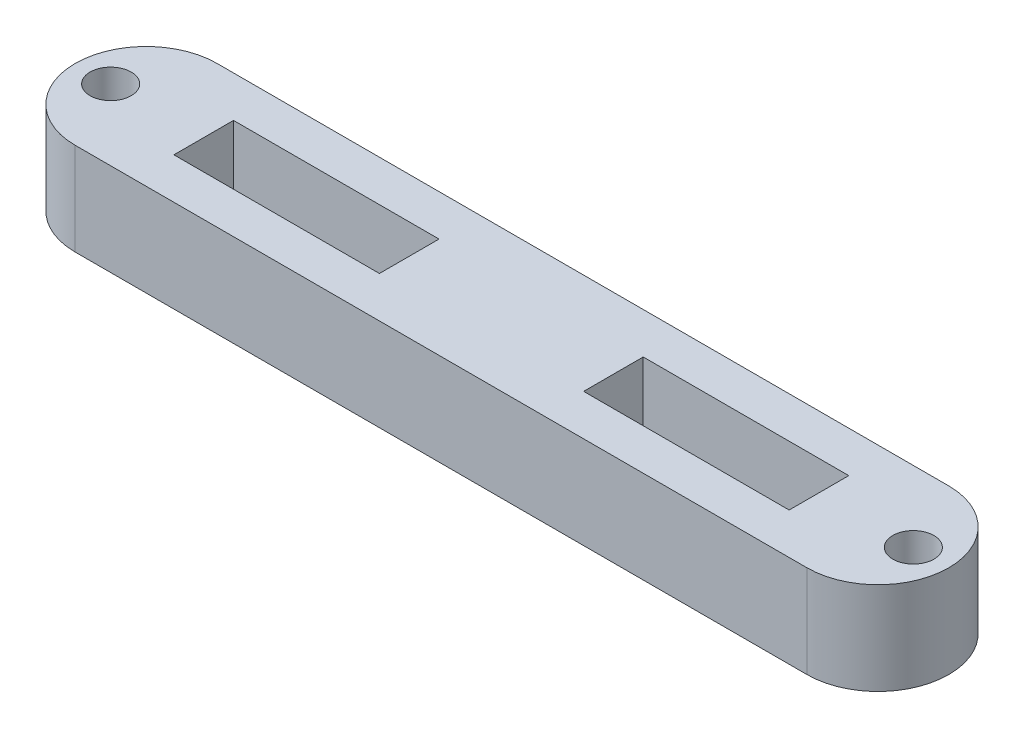
from build123d import *

# Parameters (mm, degrees)
SKETCH1_W                = 22.609360872
SKETCH1_H                = 4.3815
SKETCH1_W_2              = 6.35
SKETCH1_H_2              = 1.8415
BOSS_EXTRUDE1_DEPTH      = 6.35
BOSS_EXTRUDE2_REACH      = 15.15
BOSS_EXTRUDE3_START      = 2.19075
BOSS_EXTRUDE3_DEPTH      = 2.19075
SKETCH7_R                = 1.5875
BOSS_EXTRUDE4_DEPTH      = 1.27
MIRROR2_COPY_1_SKETCH_R  = 1.5875
MIRROR2_COPY_1_DEPTH     = 1.27
BOSS_EXTRUDE5_DEPTH      = 6.35
BOSS_EXTRUDE5_DEPTH_BACK = 1.27
SKETCH8_R                = 0.635
SKETCH9_W                = 22.609360872
SKETCH9_H                = 6.35
BOSS_EXTRUDE6_DEPTH      = 4.3815
SKETCH10_W               = 6.35
SKETCH10_H               = 1.8415
CUT_EXTRUDE1_DEPTH       = 12.7
CUT_EXTRUDE2_DEPTH       = 23.114
CUT_EXTRUDE2_DEPTH_BACK  = 4.7625
SKETCH12_W               = 31.633822951
SKETCH12_H               = 14.456952732


with BuildPart() as part:
    # Sketch1 → Boss-Extrude1 (new body)
    with BuildSketch(Plane(origin=(0, 0, 0), x_dir=(1, 0, 0), z_dir=(0, 1, 0))):
        Rectangle(SKETCH1_W, SKETCH1_H)
        with Locations((-6.35, 0)):
            Rectangle(SKETCH1_W_2, SKETCH1_H_2, mode=Mode.SUBTRACT)
        with Locations((6.308703221, 0)):
            Rectangle(SKETCH1_W_2, SKETCH1_H_2, mode=Mode.SUBTRACT)
    extrude(amount=BOSS_EXTRUDE1_DEPTH)

    # Boss-Extrude2: up to this face of the body (flat: up to its plane)
    boss_extrude2_end = Plane(part.part.faces().sort_by_distance((0, 3.175, -2.19075))[0])
    # Sketch2 → Boss-Extrude2 (add, up to the picked face)
    with BuildSketch(Plane.XY, mode=Mode.PRIVATE) as boss_extrude2_sk1:
        with BuildLine():
            Line((3.175, 0), (-3.175, 0))
            ThreePointArc((-3.175, 0), (0, -3.175), (3.175, 0))
        make_face()
    boss_extrude2_tool1 = split(extrude(boss_extrude2_sk1.sketch, amount=-BOSS_EXTRUDE2_REACH, mode=Mode.PRIVATE), bisect_by=boss_extrude2_end, keep=Keep.BOTH, mode=Mode.PRIVATE)
    add(boss_extrude2_tool1.solids().sort_by(Axis((0, -1.347512, 0), (0, 0, -1)))[0])

    # Sketch2<3> → Boss-Extrude3 (add)
    with BuildSketch(Plane.XY.offset(BOSS_EXTRUDE3_START)):
        with BuildLine():
            Line((3.175, 0), (-3.175, 0))
            ThreePointArc((-3.175, 0), (0, -3.175), (3.175, 0))
        make_face()
    extrude(amount=-BOSS_EXTRUDE3_DEPTH)

    # Sketch7 → Boss-Extrude4 (add)
    with BuildSketch(Plane.XY.offset(2.19075)):
        with BuildLine():
            Line((-9.525, 0), (-11.304680436, 0))
            Line((-11.304680436, 0), (-11.304680436, -12.7))
            ThreePointArc((-11.304680436, -12.7), (-8.266575896, -13.958424104), (-9.525, -10.920319564))
            Line((-9.525, -10.920319564), (-9.525, 0))
        make_face()
        with Locations((-9.525, -12.7)):
            Circle(SKETCH7_R, mode=Mode.SUBTRACT)
    boss_extrude4 = extrude(amount=-BOSS_EXTRUDE4_DEPTH)

    # Mirror1: Boss-Extrude4 across plane
    add(boss_extrude4.mirror(Plane(origin=(0, 0, 0), x_dir=(0, 0, 1), z_dir=(1, 0, 0))))

    # Mirror2: Boss-Extrude4 across plane
    add(boss_extrude4.mirror(Plane.XY))

    # Mirror2 copy 1 sketch → Mirror2 copy 1 (add)
    with BuildSketch(Plane(origin=(0, 0, -2.19075), x_dir=(-1, 0, 0), z_dir=(0, 0, -1))):
        with BuildLine():
            Line((-9.525, 0), (-11.304680436, 0))
            Line((-11.304680436, 0), (-11.304680436, -12.7))
            ThreePointArc((-11.304680436, -12.7), (-8.266575896, -13.958424104), (-9.525, -10.920319564))
            Line((-9.525, -10.920319564), (-9.525, 0))
        make_face()
        with Locations((-9.525, -12.7)):
            Circle(MIRROR2_COPY_1_SKETCH_R, mode=Mode.SUBTRACT)
    extrude(amount=-MIRROR2_COPY_1_DEPTH)

    # Sketch8 → Boss-Extrude5 (add, two sides: drawn at the far end of the back side and taken through both)
    # profile 1 of 2: a face of its own
    with BuildSketch(Plane(origin=(0, 6.35, 0), x_dir=(1, 0, 0), z_dir=(0, 1, 0)).offset(-BOSS_EXTRUDE5_DEPTH_BACK)):
        with BuildLine():
            Line((-11.304680436, 2.19075), (-11.304680436, -2.19075))
            ThreePointArc((-11.304680436, -2.19075), (-13.495430436, 0), (-11.304680436, 2.19075))
        make_face()
        with Locations(Location((-12.400055436, 0, 0), (0, 0, 270))):
            Circle(SKETCH8_R, mode=Mode.SUBTRACT)
    # profile 2 of 2: a face of its own
    with BuildSketch(Plane(origin=(0, 6.35, 0), x_dir=(1, 0, 0), z_dir=(0, 1, 0)).offset(-BOSS_EXTRUDE5_DEPTH_BACK)):
        with BuildLine():
            Line((11.304680436, 2.19075), (11.304680436, -2.19075))
            ThreePointArc((11.304680436, -2.19075), (13.495430436, 0), (11.304680436, 2.19075))
        make_face()
        with Locations(Location((12.400055436, 0, 0), (0, 0, 90))):
            Circle(SKETCH8_R, mode=Mode.SUBTRACT)
    extrude(amount=BOSS_EXTRUDE5_DEPTH + BOSS_EXTRUDE5_DEPTH_BACK)

    # Sketch9 → Boss-Extrude6 (add)
    with BuildSketch(Plane(origin=(0, 0, -2.19075), x_dir=(-1, 0, 0), z_dir=(0, 0, -1))):
        with Locations((0, 9.525)):
            Rectangle(SKETCH9_W, SKETCH9_H)
    extrude(amount=-BOSS_EXTRUDE6_DEPTH)

    # Sketch10 → Cut-Extrude1 (cut)
    with BuildSketch(Plane(origin=(0, 12.7, 0), x_dir=(1, 0, 0), z_dir=(0, 1, 0))):
        with Locations((6.308703221, 0)):
            Rectangle(SKETCH10_W, SKETCH10_H)
        with Locations((-6.35, 0)):
            Rectangle(SKETCH10_W, SKETCH10_H)
    extrude(amount=-CUT_EXTRUDE1_DEPTH, mode=Mode.SUBTRACT)

    # Sketch12 → Cut-Extrude2 (cut, two sides: drawn at the far end of the back side and taken through both)
    with BuildSketch(Plane(origin=(0, 5.08, 0), x_dir=(-1, 0, 0), z_dir=(0, -1, 0)).offset(-CUT_EXTRUDE2_DEPTH_BACK)):
        with Locations((-0.08433307, 1.389523064)):
            Rectangle(SKETCH12_W, SKETCH12_H)
    extrude(amount=CUT_EXTRUDE2_DEPTH + CUT_EXTRUDE2_DEPTH_BACK, mode=Mode.SUBTRACT)


solid = part.part
